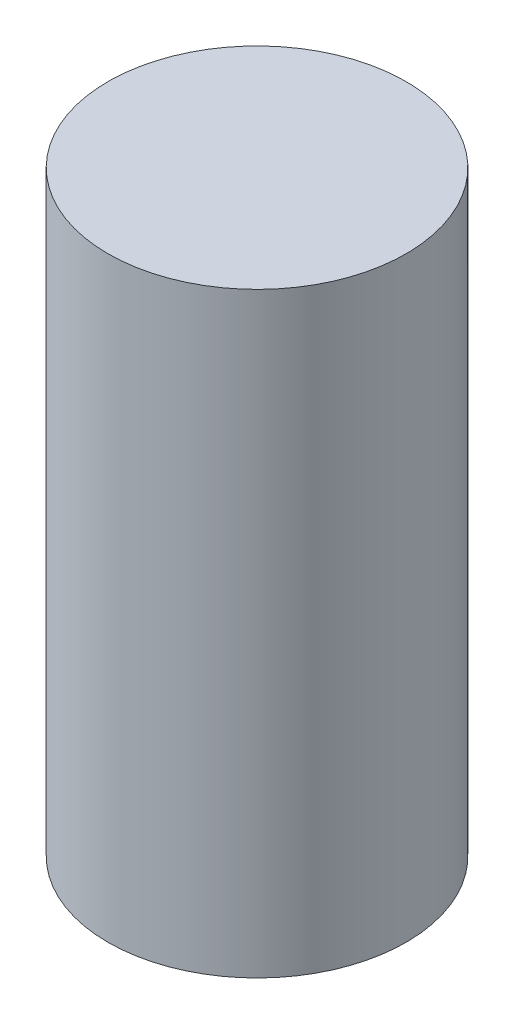
from build123d import *

# Parameters (mm, degrees)
SKETCH1_R           = 25.4
BOSS_EXTRUDE1_DEPTH = 101.6


with BuildPart() as part:
    # Sketch1 → Boss-Extrude1 (new body)
    with BuildSketch(Plane(origin=(0, 0, 0), x_dir=(1, 0, 0), z_dir=(0, 1, 0))):
        with Locations(Location((0, 0, 0), (0, 0, 270))):
            Circle(SKETCH1_R)
    extrude(amount=BOSS_EXTRUDE1_DEPTH)


solid = part.part
